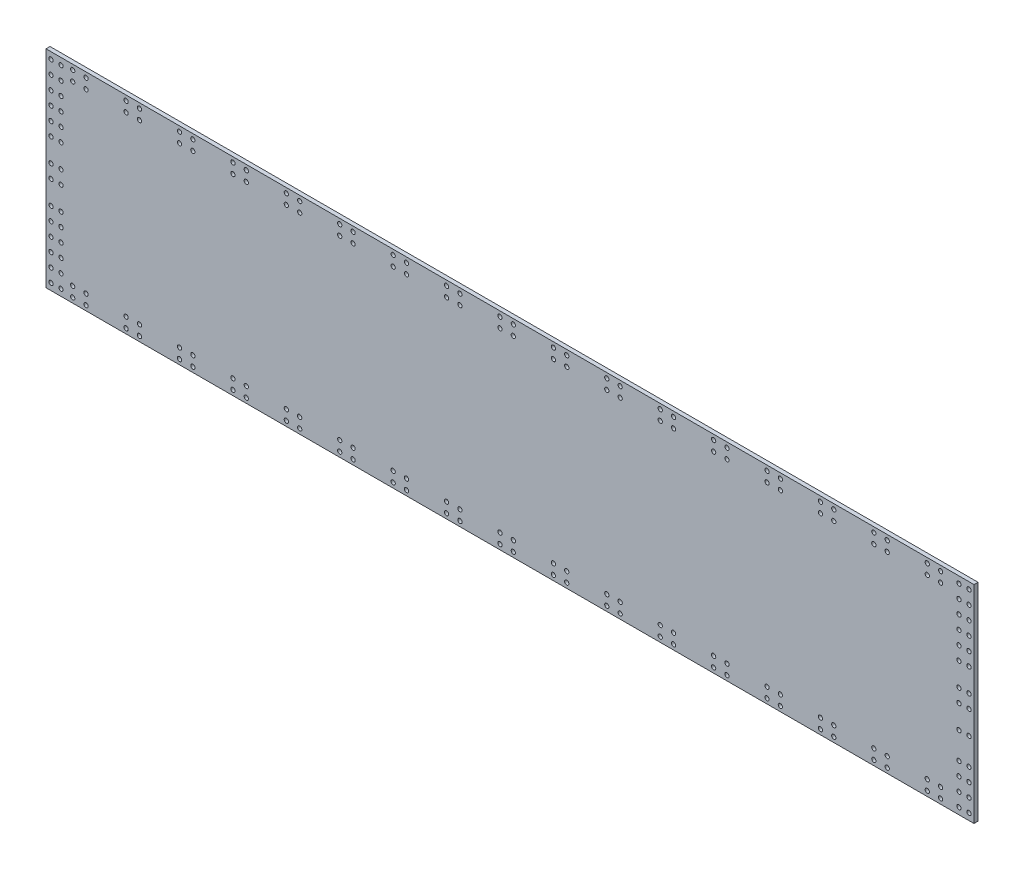
from build123d import *

# Parameters (mm, degrees)
SKETCH_1_W          = 695
SKETCH_1_H          = 155
EXTRUDE_1_DEPTH     = 3
SKETCH_2_R          = 1.6
CUT_EXTRUDE_1_DEPTH = 3


with BuildPart() as part:
    # 草图1 → 凸台-拉伸1 (new body)
    with BuildSketch(Plane.XY):
        with Locations((347.5, -77.5)):
            Rectangle(SKETCH_1_W, SKETCH_1_H)
    extrude(amount=EXTRUDE_1_DEPTH)

    # 草图2 → 切除-拉伸1 (cut)
    with BuildSketch(Plane.XY.offset(3)):
        with Locations((20, -151.25)):
            Circle(SKETCH_2_R)
        with Locations(Location((20, -143.75, 0), (0, 0, 180))):
            Circle(SKETCH_2_R)
        with Locations(Location((30, -151.25, 0), (0, 0, 180))):
            Circle(SKETCH_2_R)
        with Locations((30, -143.75)):
            Circle(SKETCH_2_R)
        with Locations((3.75, -130)):
            Circle(SKETCH_2_R)
        with Locations(Location((3.75, -120, 0), (0, 0, 180))):
            Circle(SKETCH_2_R)
        with Locations(Location((11.25, -130, 0), (0, 0, 180))):
            Circle(SKETCH_2_R)
        with Locations((11.25, -120)):
            Circle(SKETCH_2_R)
        with Locations(Location((11.25, -35, 0), (0, 0, 180))):
            Circle(SKETCH_2_R)
        with Locations((11.25, -25)):
            Circle(SKETCH_2_R)
        with Locations((3.75, -35)):
            Circle(SKETCH_2_R)
        with Locations(Location((3.75, -25, 0), (0, 0, 180))):
            Circle(SKETCH_2_R)
        with Locations(Location((30, -11.25, 0), (0, 0, 180))):
            Circle(SKETCH_2_R)
        with Locations((30, -3.75)):
            Circle(SKETCH_2_R)
        with Locations((20, -11.25)):
            Circle(SKETCH_2_R)
        with Locations(Location((20, -3.75, 0), (0, 0, 180))):
            Circle(SKETCH_2_R)
        with Locations((691.25, -25)):
            Circle(SKETCH_2_R)
        with Locations(Location((691.25, -35, 0), (0, 0, 180))):
            Circle(SKETCH_2_R)
        with Locations(Location((683.75, -25, 0), (0, 0, 180))):
            Circle(SKETCH_2_R)
        with Locations((683.75, -35)):
            Circle(SKETCH_2_R)
        with Locations(Location((683.75, -120, 0), (0, 0, 180))):
            Circle(SKETCH_2_R)
        with Locations((683.75, -130)):
            Circle(SKETCH_2_R)
        with Locations((691.25, -120)):
            Circle(SKETCH_2_R)
        with Locations(Location((691.25, -130, 0), (0, 0, 180))):
            Circle(SKETCH_2_R)
        with Locations((3.75, -55)):
            Circle(SKETCH_2_R)
        with Locations(Location((3.75, -45, 0), (0, 0, 180))):
            Circle(SKETCH_2_R)
        with Locations(Location((11.25, -55, 0), (0, 0, 180))):
            Circle(SKETCH_2_R)
        with Locations((11.25, -45)):
            Circle(SKETCH_2_R)
        with Locations(Location((11.25, -110, 0), (0, 0, 180))):
            Circle(SKETCH_2_R)
        with Locations((11.25, -100)):
            Circle(SKETCH_2_R)
        with Locations((3.75, -110)):
            Circle(SKETCH_2_R)
        with Locations(Location((3.75, -100, 0), (0, 0, 180))):
            Circle(SKETCH_2_R)
        with Locations((691.25, -100)):
            Circle(SKETCH_2_R)
        with Locations(Location((683.75, -100, 0), (0, 0, 180))):
            Circle(SKETCH_2_R)
        with Locations(Location((683.75, -45, 0), (0, 0, 180))):
            Circle(SKETCH_2_R)
        with Locations((683.75, -55)):
            Circle(SKETCH_2_R)
        with Locations((691.25, -45)):
            Circle(SKETCH_2_R)
        with Locations(Location((691.25, -55, 0), (0, 0, 180))):
            Circle(SKETCH_2_R)
        with Locations((3.75, -72.5)):
            Circle(SKETCH_2_R)
        with Locations(Location((11.25, -72.5, 0), (0, 0, 180))):
            Circle(SKETCH_2_R)
        with Locations((11.25, -82.5)):
            Circle(SKETCH_2_R)
        with Locations(Location((3.75, -82.5, 0), (0, 0, 180))):
            Circle(SKETCH_2_R)
        with Locations((691.25, -82.5)):
            Circle(SKETCH_2_R)
        with Locations(Location((683.75, -82.5, 0), (0, 0, 180))):
            Circle(SKETCH_2_R)
        with Locations((683.75, -72.5)):
            Circle(SKETCH_2_R)
        with Locations(Location((691.25, -72.5, 0), (0, 0, 180))):
            Circle(SKETCH_2_R)
        with Locations(Location((60, -143.75, 0), (0, 0, 180))):
            Circle(SKETCH_2_R)
        with Locations((70, -143.75)):
            Circle(SKETCH_2_R)
        with Locations((60, -151.25)):
            Circle(SKETCH_2_R)
        with Locations(Location((70, -151.25, 0), (0, 0, 180))):
            Circle(SKETCH_2_R)
        with Locations(Location((100, -143.75, 0), (0, 0, 180))):
            Circle(SKETCH_2_R)
        with Locations((110, -143.75)):
            Circle(SKETCH_2_R)
        with Locations((100, -151.25)):
            Circle(SKETCH_2_R)
        with Locations(Location((110, -151.25, 0), (0, 0, 180))):
            Circle(SKETCH_2_R)
        with Locations(Location((140, -143.75, 0), (0, 0, 180))):
            Circle(SKETCH_2_R)
        with Locations((150, -143.75)):
            Circle(SKETCH_2_R)
        with Locations((140, -151.25)):
            Circle(SKETCH_2_R)
        with Locations(Location((150, -151.25, 0), (0, 0, 180))):
            Circle(SKETCH_2_R)
        with Locations(Location((180, -143.75, 0), (0, 0, 180))):
            Circle(SKETCH_2_R)
        with Locations((190, -143.75)):
            Circle(SKETCH_2_R)
        with Locations((180, -151.25)):
            Circle(SKETCH_2_R)
        with Locations(Location((190, -151.25, 0), (0, 0, 180))):
            Circle(SKETCH_2_R)
        with Locations(Location((220, -143.75, 0), (0, 0, 180))):
            Circle(SKETCH_2_R)
        with Locations((230, -143.75)):
            Circle(SKETCH_2_R)
        with Locations((220, -151.25)):
            Circle(SKETCH_2_R)
        with Locations(Location((230, -151.25, 0), (0, 0, 180))):
            Circle(SKETCH_2_R)
        with Locations(Location((260, -143.75, 0), (0, 0, 180))):
            Circle(SKETCH_2_R)
        with Locations((270, -143.75)):
            Circle(SKETCH_2_R)
        with Locations((260, -151.25)):
            Circle(SKETCH_2_R)
        with Locations(Location((270, -151.25, 0), (0, 0, 180))):
            Circle(SKETCH_2_R)
        with Locations(Location((300, -143.75, 0), (0, 0, 180))):
            Circle(SKETCH_2_R)
        with Locations((310, -143.75)):
            Circle(SKETCH_2_R)
        with Locations((300, -151.25)):
            Circle(SKETCH_2_R)
        with Locations(Location((310, -151.25, 0), (0, 0, 180))):
            Circle(SKETCH_2_R)
        with Locations(Location((340, -143.75, 0), (0, 0, 180))):
            Circle(SKETCH_2_R)
        with Locations((350, -143.75)):
            Circle(SKETCH_2_R)
        with Locations((340, -151.25)):
            Circle(SKETCH_2_R)
        with Locations(Location((350, -151.25, 0), (0, 0, 180))):
            Circle(SKETCH_2_R)
        with Locations(Location((380, -143.75, 0), (0, 0, 180))):
            Circle(SKETCH_2_R)
        with Locations((390, -143.75)):
            Circle(SKETCH_2_R)
        with Locations((380, -151.25)):
            Circle(SKETCH_2_R)
        with Locations(Location((390, -151.25, 0), (0, 0, 180))):
            Circle(SKETCH_2_R)
        with Locations(Location((420, -143.75, 0), (0, 0, 180))):
            Circle(SKETCH_2_R)
        with Locations((430, -143.75)):
            Circle(SKETCH_2_R)
        with Locations((420, -151.25)):
            Circle(SKETCH_2_R)
        with Locations(Location((430, -151.25, 0), (0, 0, 180))):
            Circle(SKETCH_2_R)
        with Locations(Location((460, -143.75, 0), (0, 0, 180))):
            Circle(SKETCH_2_R)
        with Locations((470, -143.75)):
            Circle(SKETCH_2_R)
        with Locations((460, -151.25)):
            Circle(SKETCH_2_R)
        with Locations(Location((470, -151.25, 0), (0, 0, 180))):
            Circle(SKETCH_2_R)
        with Locations(Location((500, -143.75, 0), (0, 0, 180))):
            Circle(SKETCH_2_R)
        with Locations((510, -143.75)):
            Circle(SKETCH_2_R)
        with Locations((500, -151.25)):
            Circle(SKETCH_2_R)
        with Locations(Location((510, -151.25, 0), (0, 0, 180))):
            Circle(SKETCH_2_R)
        with Locations(Location((540, -143.75, 0), (0, 0, 180))):
            Circle(SKETCH_2_R)
        with Locations((550, -143.75)):
            Circle(SKETCH_2_R)
        with Locations((540, -151.25)):
            Circle(SKETCH_2_R)
        with Locations(Location((550, -151.25, 0), (0, 0, 180))):
            Circle(SKETCH_2_R)
        with Locations(Location((580, -143.75, 0), (0, 0, 180))):
            Circle(SKETCH_2_R)
        with Locations((590, -143.75)):
            Circle(SKETCH_2_R)
        with Locations((580, -151.25)):
            Circle(SKETCH_2_R)
        with Locations(Location((590, -151.25, 0), (0, 0, 180))):
            Circle(SKETCH_2_R)
        with Locations(Location((620, -143.75, 0), (0, 0, 180))):
            Circle(SKETCH_2_R)
        with Locations((630, -143.75)):
            Circle(SKETCH_2_R)
        with Locations((620, -151.25)):
            Circle(SKETCH_2_R)
        with Locations(Location((630, -151.25, 0), (0, 0, 180))):
            Circle(SKETCH_2_R)
        with Locations(Location((660, -143.75, 0), (0, 0, 180))):
            Circle(SKETCH_2_R)
        with Locations((670, -143.75)):
            Circle(SKETCH_2_R)
        with Locations((660, -151.25)):
            Circle(SKETCH_2_R)
        with Locations(Location((670, -151.25, 0), (0, 0, 180))):
            Circle(SKETCH_2_R)
        with Locations(Location((60, -3.75, 0), (0, 0, 180))):
            Circle(SKETCH_2_R)
        with Locations((70, -3.75)):
            Circle(SKETCH_2_R)
        with Locations((60, -11.25)):
            Circle(SKETCH_2_R)
        with Locations(Location((70, -11.25, 0), (0, 0, 180))):
            Circle(SKETCH_2_R)
        with Locations(Location((100, -3.75, 0), (0, 0, 180))):
            Circle(SKETCH_2_R)
        with Locations((110, -3.75)):
            Circle(SKETCH_2_R)
        with Locations((100, -11.25)):
            Circle(SKETCH_2_R)
        with Locations(Location((110, -11.25, 0), (0, 0, 180))):
            Circle(SKETCH_2_R)
        with Locations(Location((140, -3.75, 0), (0, 0, 180))):
            Circle(SKETCH_2_R)
        with Locations((150, -3.75)):
            Circle(SKETCH_2_R)
        with Locations((140, -11.25)):
            Circle(SKETCH_2_R)
        with Locations(Location((150, -11.25, 0), (0, 0, 180))):
            Circle(SKETCH_2_R)
        with Locations(Location((180, -3.75, 0), (0, 0, 180))):
            Circle(SKETCH_2_R)
        with Locations((190, -3.75)):
            Circle(SKETCH_2_R)
        with Locations((180, -11.25)):
            Circle(SKETCH_2_R)
        with Locations(Location((190, -11.25, 0), (0, 0, 180))):
            Circle(SKETCH_2_R)
        with Locations(Location((220, -3.75, 0), (0, 0, 180))):
            Circle(SKETCH_2_R)
        with Locations((230, -3.75)):
            Circle(SKETCH_2_R)
        with Locations((220, -11.25)):
            Circle(SKETCH_2_R)
        with Locations(Location((230, -11.25, 0), (0, 0, 180))):
            Circle(SKETCH_2_R)
        with Locations(Location((260, -3.75, 0), (0, 0, 180))):
            Circle(SKETCH_2_R)
        with Locations((270, -3.75)):
            Circle(SKETCH_2_R)
        with Locations((260, -11.25)):
            Circle(SKETCH_2_R)
        with Locations(Location((270, -11.25, 0), (0, 0, 180))):
            Circle(SKETCH_2_R)
        with Locations(Location((300, -3.75, 0), (0, 0, 180))):
            Circle(SKETCH_2_R)
        with Locations((310, -3.75)):
            Circle(SKETCH_2_R)
        with Locations((300, -11.25)):
            Circle(SKETCH_2_R)
        with Locations(Location((310, -11.25, 0), (0, 0, 180))):
            Circle(SKETCH_2_R)
        with Locations(Location((340, -3.75, 0), (0, 0, 180))):
            Circle(SKETCH_2_R)
        with Locations((350, -3.75)):
            Circle(SKETCH_2_R)
        with Locations((340, -11.25)):
            Circle(SKETCH_2_R)
        with Locations(Location((350, -11.25, 0), (0, 0, 180))):
            Circle(SKETCH_2_R)
        with Locations(Location((380, -3.75, 0), (0, 0, 180))):
            Circle(SKETCH_2_R)
        with Locations((390, -3.75)):
            Circle(SKETCH_2_R)
        with Locations((380, -11.25)):
            Circle(SKETCH_2_R)
        with Locations(Location((390, -11.25, 0), (0, 0, 180))):
            Circle(SKETCH_2_R)
        with Locations(Location((420, -3.75, 0), (0, 0, 180))):
            Circle(SKETCH_2_R)
        with Locations((430, -3.75)):
            Circle(SKETCH_2_R)
        with Locations((420, -11.25)):
            Circle(SKETCH_2_R)
        with Locations(Location((430, -11.25, 0), (0, 0, 180))):
            Circle(SKETCH_2_R)
        with Locations(Location((460, -3.75, 0), (0, 0, 180))):
            Circle(SKETCH_2_R)
        with Locations((470, -3.75)):
            Circle(SKETCH_2_R)
        with Locations((460, -11.25)):
            Circle(SKETCH_2_R)
        with Locations(Location((470, -11.25, 0), (0, 0, 180))):
            Circle(SKETCH_2_R)
        with Locations(Location((500, -3.75, 0), (0, 0, 180))):
            Circle(SKETCH_2_R)
        with Locations((510, -3.75)):
            Circle(SKETCH_2_R)
        with Locations((500, -11.25)):
            Circle(SKETCH_2_R)
        with Locations(Location((510, -11.25, 0), (0, 0, 180))):
            Circle(SKETCH_2_R)
        with Locations(Location((540, -3.75, 0), (0, 0, 180))):
            Circle(SKETCH_2_R)
        with Locations((550, -3.75)):
            Circle(SKETCH_2_R)
        with Locations((540, -11.25)):
            Circle(SKETCH_2_R)
        with Locations(Location((550, -11.25, 0), (0, 0, 180))):
            Circle(SKETCH_2_R)
        with Locations(Location((580, -3.75, 0), (0, 0, 180))):
            Circle(SKETCH_2_R)
        with Locations((590, -3.75)):
            Circle(SKETCH_2_R)
        with Locations((580, -11.25)):
            Circle(SKETCH_2_R)
        with Locations(Location((590, -11.25, 0), (0, 0, 180))):
            Circle(SKETCH_2_R)
        with Locations(Location((620, -3.75, 0), (0, 0, 180))):
            Circle(SKETCH_2_R)
        with Locations((630, -3.75)):
            Circle(SKETCH_2_R)
        with Locations((620, -11.25)):
            Circle(SKETCH_2_R)
        with Locations(Location((630, -11.25, 0), (0, 0, 180))):
            Circle(SKETCH_2_R)
        with Locations(Location((660, -3.75, 0), (0, 0, 180))):
            Circle(SKETCH_2_R)
        with Locations((670, -3.75)):
            Circle(SKETCH_2_R)
        with Locations((660, -11.25)):
            Circle(SKETCH_2_R)
        with Locations(Location((670, -11.25, 0), (0, 0, 180))):
            Circle(SKETCH_2_R)
        with Locations((3.75, -150)):
            Circle(SKETCH_2_R)
        with Locations(Location((3.75, -140, 0), (0, 0, 180))):
            Circle(SKETCH_2_R)
        with Locations(Location((11.25, -150, 0), (0, 0, 180))):
            Circle(SKETCH_2_R)
        with Locations((11.25, -140)):
            Circle(SKETCH_2_R)
        with Locations(Location((11.25, -15, 0), (0, 0, 180))):
            Circle(SKETCH_2_R)
        with Locations((11.25, -5)):
            Circle(SKETCH_2_R)
        with Locations((3.75, -15)):
            Circle(SKETCH_2_R)
        with Locations(Location((3.75, -5, 0), (0, 0, 180))):
            Circle(SKETCH_2_R)
        with Locations(Location((683.75, -140, 0), (0, 0, 180))):
            Circle(SKETCH_2_R)
        with Locations((683.75, -150)):
            Circle(SKETCH_2_R)
        with Locations((691.25, -140)):
            Circle(SKETCH_2_R)
        with Locations(Location((691.25, -150, 0), (0, 0, 180))):
            Circle(SKETCH_2_R)
        with Locations((691.25, -5)):
            Circle(SKETCH_2_R)
        with Locations(Location((691.25, -15, 0), (0, 0, 180))):
            Circle(SKETCH_2_R)
        with Locations(Location((683.75, -5, 0), (0, 0, 180))):
            Circle(SKETCH_2_R)
        with Locations((683.75, -15)):
            Circle(SKETCH_2_R)
    extrude(amount=-CUT_EXTRUDE_1_DEPTH, mode=Mode.SUBTRACT)


solid = part.part
